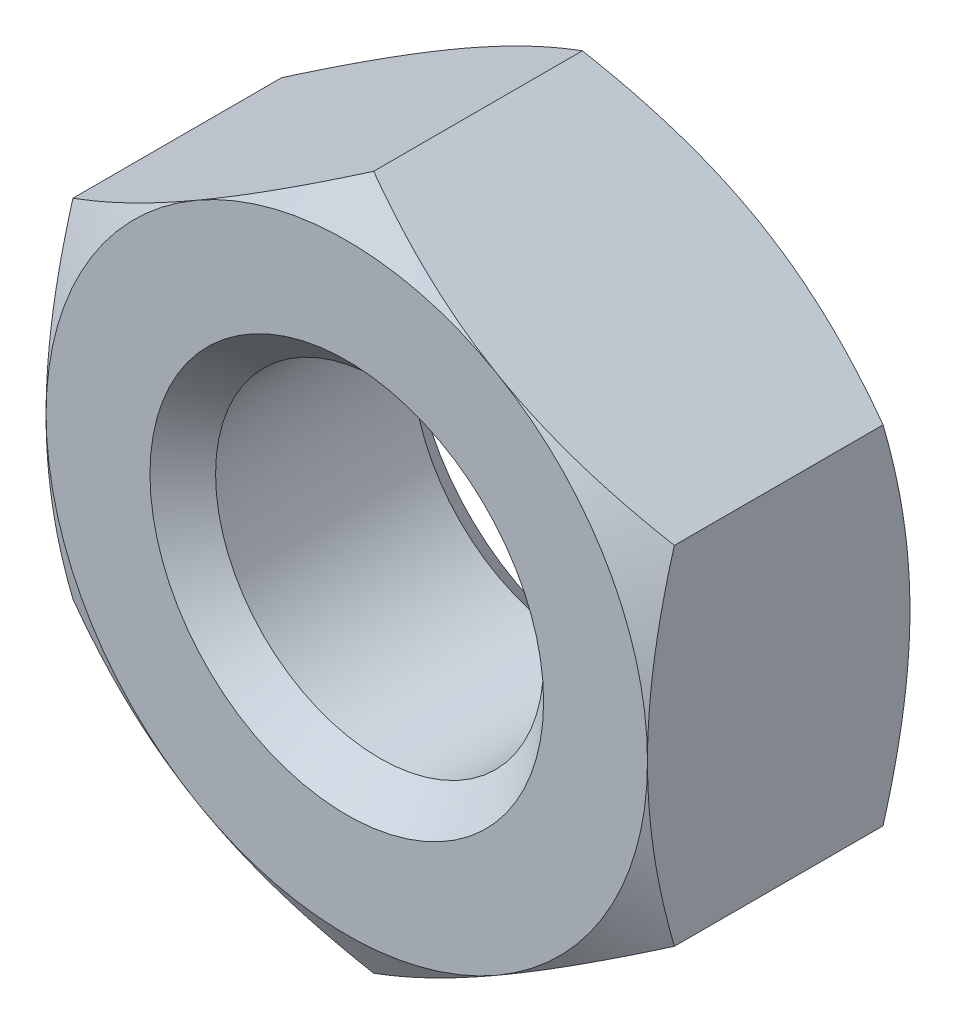
from build123d import *

# Parameters (mm, degrees)
SKETCH1_R           = 3.25
SKETCH1_R_2         = 1.5
BOSS_EXTRUDE1_DEPTH = 2.4
CHAMFER1_SIZE       = 0.5
CHAMFER1_SIZE2      = 0.288675135
CHAMFER2_SIZE       = 0.5
CHAMFER2_SIZE2      = 0.288675135
SKETCH1_3_R         = 3.25
CUT_EXTRUDE1_DEPTH  = 6.185074734
CHAMFER3_SIZE       = 0.3


with BuildPart() as part:
    # Sketch1 → Boss-Extrude1 (new body)
    # profile 1 of 2: a face of its own
    with BuildSketch(Plane.XY):
        Circle(SKETCH1_R)
        Polygon((2.75, 1.58771324), (0, 3.175426481), (-2.75, 1.58771324), (-2.75, -1.58771324), (0, -3.175426481), (2.75, -1.58771324), align=None, mode=Mode.SUBTRACT)
    # profile 2 of 2: a face of its own
    with BuildSketch(Plane.XY):
        Polygon((2.75, -1.58771324), (2.75, 1.58771324), (0, 3.175426481), (-2.75, 1.58771324), (-2.75, -1.58771324), (0, -3.175426481), align=None)
        Circle(SKETCH1_R_2, mode=Mode.SUBTRACT)
    extrude(amount=BOSS_EXTRUDE1_DEPTH)

    # Chamfer1
    chamfer1_edges = [part.edges().sort_by_distance(p)[0] for p in [
        (-3.25, 0, 2.4),
    ]]
    chamfer1_side = [part.faces().sort_by_distance(p)[0] for p in [
        (-3.158076118, 0, 2.4),
    ]]
    chamfer(chamfer1_edges, length=CHAMFER1_SIZE, length2=CHAMFER1_SIZE2, reference=chamfer1_side[0])

    # Chamfer2
    chamfer2_edges = [part.edges().sort_by_distance(p)[0] for p in [
        (-3.25, 0, 0),
    ]]
    chamfer2_side = [part.faces().sort_by_distance(p)[0] for p in [
        (-3.158076118, 0, 0),
    ]]
    chamfer(chamfer2_edges, length=CHAMFER2_SIZE, length2=CHAMFER2_SIZE2, reference=chamfer2_side[0])

    # Sketch1<3> → Cut-Extrude1 (cut, through all)
    with BuildSketch(Plane.XY):
        Circle(SKETCH1_3_R)
        Polygon((2.75, 1.58771324), (0, 3.175426481), (-2.75, 1.58771324), (-2.75, -1.58771324), (0, -3.175426481), (2.75, -1.58771324), align=None, mode=Mode.SUBTRACT)
    extrude(amount=CUT_EXTRUDE1_DEPTH, mode=Mode.SUBTRACT)

    # Chamfer3
    chamfer3_edges = [part.edges().sort_by_distance(p)[0] for p in [
        (-1.5, 0, 0),
        (-1.5, 0, 2.4),
    ]]
    chamfer(chamfer3_edges, length=CHAMFER3_SIZE)


solid = part.part
